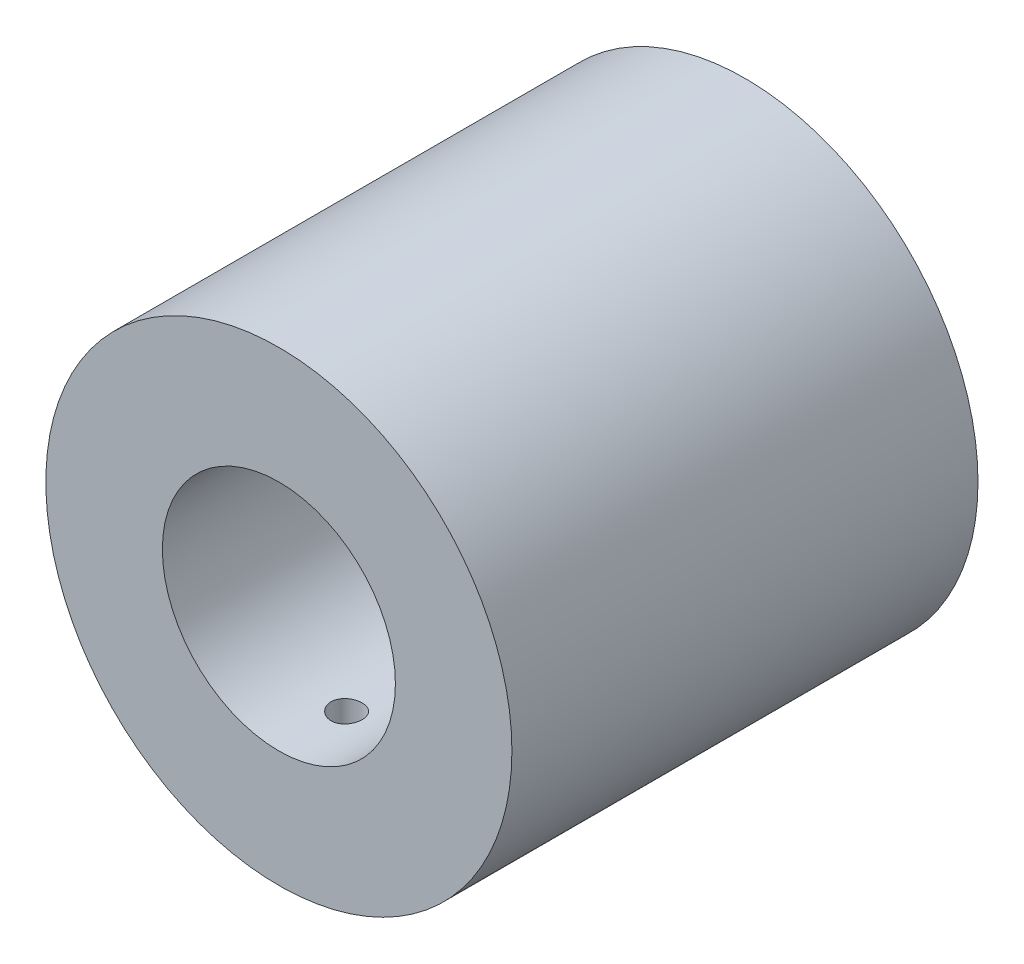
from build123d import *

# Parameters (mm, degrees)
SKETCH_1_R          = 15
SKETCH_1_R_2        = 7.5
EXTRUDE_1_DEPTH     = 30
SKETCH_2_R          = 1
CUT_EXTRUDE_1_DEPTH = 30


with BuildPart() as part:
    # 草图1 → 凸台-拉伸1 (new body)
    with BuildSketch(Plane.XY):
        Circle(SKETCH_1_R)
        Circle(SKETCH_1_R_2, mode=Mode.SUBTRACT)
    extrude(amount=EXTRUDE_1_DEPTH)

    # 草图2 → 切除-拉伸1 (cut)
    with BuildSketch(Plane(origin=(0, 0, 0), x_dir=(1, 0, 0), z_dir=(0, 1, 0))):
        with Locations(Location((0, -25.638965873, 0), (0, 0, 270))):
            Circle(SKETCH_2_R)
        with Locations(Location((0, -4.361034127, 0), (0, 0, 270))):
            Circle(SKETCH_2_R)
    extrude(amount=-CUT_EXTRUDE_1_DEPTH, mode=Mode.SUBTRACT)


solid = part.part
